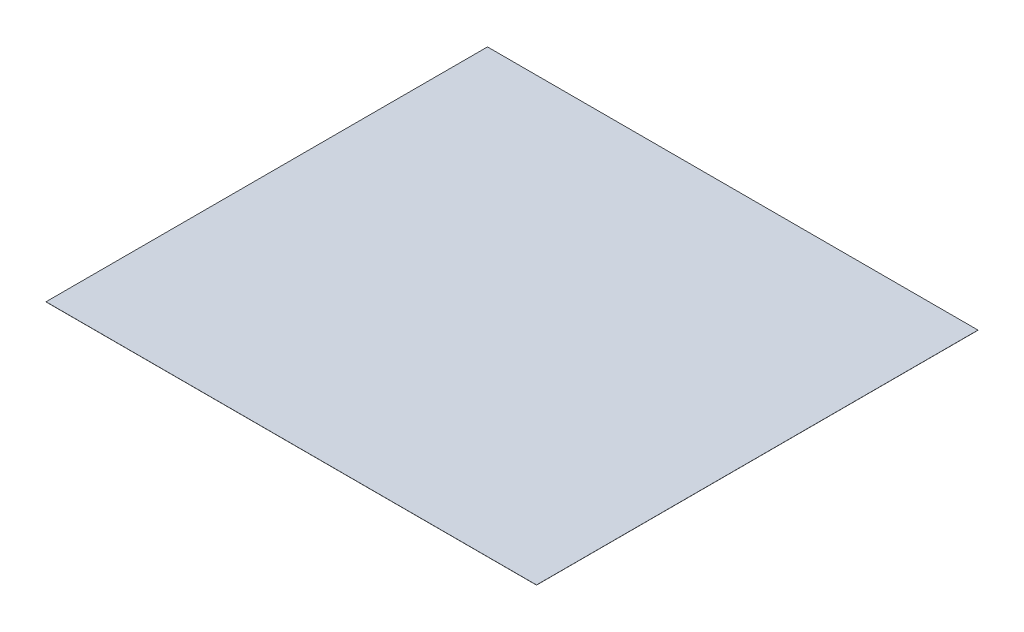
from build123d import *

# Parameters (mm, degrees)
SKETCH1_W           = 400
SKETCH1_H           = 360
BOSS_EXTRUDE1_DEPTH = 0.1


with BuildPart() as part:
    # Sketch1 → Boss-Extrude1 (new body)
    with BuildSketch(Plane(origin=(0, 0, 0), x_dir=(1, 0, 0), z_dir=(0, 1, 0))):
        with Locations((-20, 0)):
            Rectangle(SKETCH1_W, SKETCH1_H)
    extrude(amount=BOSS_EXTRUDE1_DEPTH)


solid = part.part
